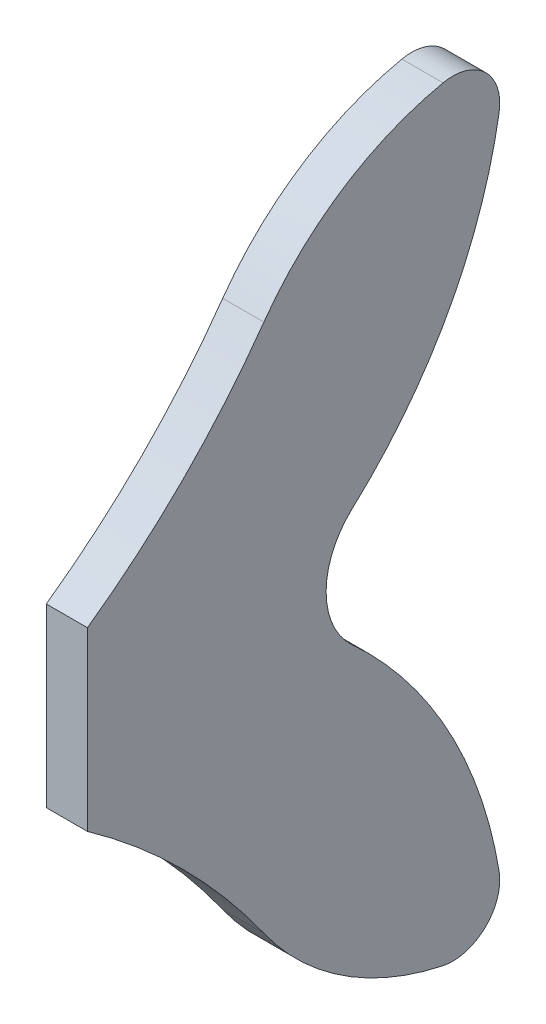
from build123d import *

# Parameters (mm, degrees)
BOSS_EXTRUDE1_DEPTH = 3.5


with BuildPart() as part:
    # Sketch1 → Boss-Extrude1 (new, symmetric)
    with BuildSketch(Plane(origin=(0, 0, 0), x_dir=(0, 0, -1), z_dir=(1, 0, 0))):
        with BuildLine():
            Line((0, 15), (0, -15))
            ThreePointArc((0, -15), (16.267428438, -28.732571562), (30, -45))
            ThreePointArc((30, -45), (43.342526908, -57.873390661), (60.45856181, -65))
            ThreePointArc((60.45856181, -65), (67.649976256, -62.944872105), (70, -55.84435235))
            ThreePointArc((70, -55.84435235), (61.345746077, -30.825000689), (45, -10))
            ThreePointArc((45, -10), (40.583973737, 0), (45, 10))
            ThreePointArc((45, 10), (61.345746077, 30.825000689), (70, 55.84435235))
            ThreePointArc((70, 55.84435235), (67.649976256, 62.944872105), (60.45856181, 65))
            ThreePointArc((60.45856181, 65), (43.342526908, 57.873390661), (30, 45))
            ThreePointArc((30, 45), (16.267428438, 28.732571562), (0, 15))
        make_face()
    extrude(amount=BOSS_EXTRUDE1_DEPTH, both=True)


solid = part.part
